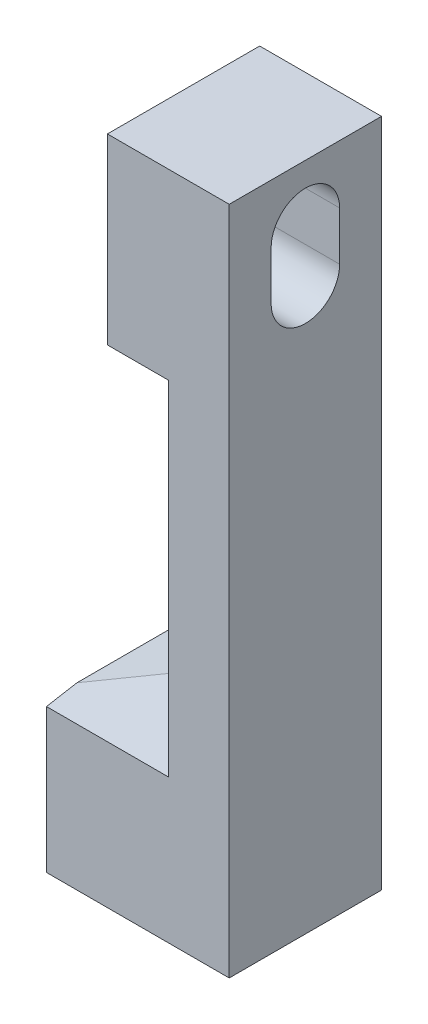
from build123d import *

# Parameters (mm, degrees)
SKETCH1_W           = 15.875
SKETCH1_H           = 69.85
BOSS_EXTRUDE1_DEPTH = 6.35
BOSS_EXTRUDE2_DEPTH = 6.35
BOSS_EXTRUDE3_DEPTH = 12.7
CUT_EXTRUDE1_DEPTH  = 41.411152545
CUT_EXTRUDE2_DEPTH  = 39.000651721


with BuildPart() as part:
    # Sketch1 → Boss-Extrude1 (new body)
    with BuildSketch(Plane(origin=(0, 0, 0), x_dir=(0, 0, -1), z_dir=(1, 0, 0))):
        Rectangle(SKETCH1_W, SKETCH1_H)
    extrude(amount=BOSS_EXTRUDE1_DEPTH)

    # Sketch2 → Boss-Extrude2 (add)
    with BuildSketch(Plane.ZY):
        Polygon((7.9375, 34.925), (-7.9375, 34.925), (-7.9375, 18.674190819), (7.9375, 15.875), align=None)
    extrude(amount=BOSS_EXTRUDE2_DEPTH)

    # Sketch3 → Boss-Extrude3 (add)
    with BuildSketch(Plane.ZY):
        Polygon((-7.9375, -17.145), (-7.9375, -34.925), (7.9375, -34.925), (7.9375, -19.944190819), align=None)
    extrude(amount=BOSS_EXTRUDE3_DEPTH)

    # Sketch6 → Cut-Extrude1 (cut, through all)
    with BuildSketch(Plane(origin=(0, 0, -7.9375), x_dir=(-1, 0, 0), z_dir=(0, 0, -1))):
        Polygon((0, -17.145), (12.7, -17.145), (12.7, -19.384352655), align=None)
    extrude(amount=-CUT_EXTRUDE1_DEPTH, mode=Mode.SUBTRACT)

    # Sketch7 → Cut-Extrude2 (cut, through all)
    with BuildSketch(Plane.ZY.offset(6.35)):
        with BuildLine():
            Line((3.5687, 28.841737989), (3.5687, 23.761737989))
            ThreePointArc((3.5687, 23.761737989), (0, 20.193037989), (-3.5687, 23.761737989))
            Line((-3.5687, 23.761737989), (-3.5687, 28.841737989))
            ThreePointArc((-3.5687, 28.841737989), (0, 32.410437989), (3.5687, 28.841737989))
        make_face()
    extrude(amount=-CUT_EXTRUDE2_DEPTH, mode=Mode.SUBTRACT)


solid = part.part
